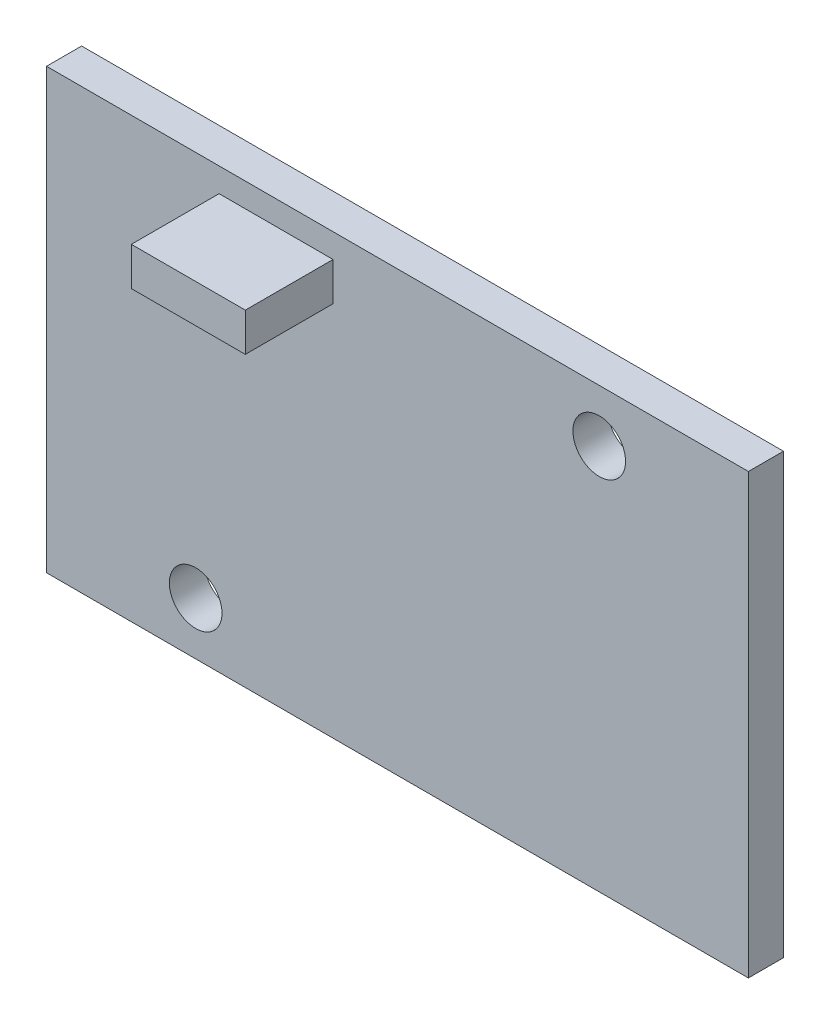
from build123d import *

# Parameters (mm, degrees)
CROQUIS1_W              = 40
CROQUIS1_H              = 25
CROQUIS1_R              = 1.5
SALIENTE_EXTRUIR1_DEPTH = 2
CROQUIS2_W              = 6.494279544
CROQUIS2_H              = 2.185045418
SALIENTE_EXTRUIR2_DEPTH = 5


with BuildPart() as part:
    # Croquis1 → Saliente-Extruir1 (new body)
    with BuildSketch(Plane.XY):
        with Locations((-7.751839327, 7.557471264)):
            Rectangle(CROQUIS1_W, CROQUIS1_H)
        with Locations((3.748160673, 17.057471264)):
            Circle(CROQUIS1_R, mode=Mode.SUBTRACT)
        with Locations((-19.251839327, -1.942528736)):
            Circle(CROQUIS1_R, mode=Mode.SUBTRACT)
    extrude(amount=SALIENTE_EXTRUIR1_DEPTH)

    # Croquis2 → Saliente-Extruir2 (add)
    with BuildSketch(Plane.XY.offset(2)):
        with Locations((-14.669910238, 17.593878177)):
            Rectangle(CROQUIS2_W, CROQUIS2_H)
    extrude(amount=SALIENTE_EXTRUIR2_DEPTH)


solid = part.part
